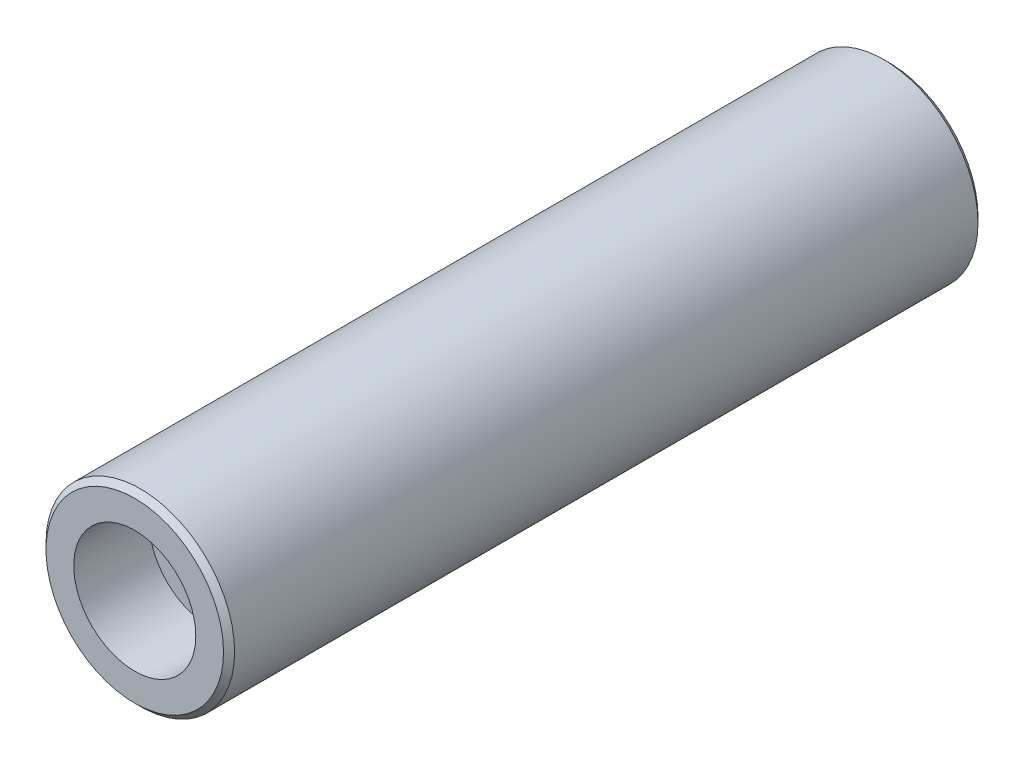
from build123d import *

# Parameters (mm, degrees)
SKETCH_1_R                = 8.5
EXTRUDE_1_DEPTH           = 68
HOLE_WIZARD_1_D           = 7
HOLE_WIZARD_1_CBORE_D     = 11
HOLE_WIZARD_1_CBORE_DEPTH = 6.8
CHAMFER_1_SIZE            = 0.5


with BuildPart() as part:
    # 草图1 → 凸台-拉伸1 (new body)
    with BuildSketch(Plane.XY):
        with Locations((-11.725470696, -50.937423366)):
            Circle(SKETCH_1_R)
    extrude(amount=EXTRUDE_1_DEPTH)

    # 打孔尺寸(%根据)内六角圆柱头螺钉的类型1 (through all)
    with Locations(Plane.XY.offset(68)):
        with Locations((-11.725470696, -50.937423366)):
            CounterBoreHole(HOLE_WIZARD_1_D / 2, HOLE_WIZARD_1_CBORE_D / 2, HOLE_WIZARD_1_CBORE_DEPTH)

    # 倒角1
    chamfer_1_edges = [part.edges().sort_by_distance(p)[0] for p in [
        (-20.225470696, -50.937423366, 0),
        (-20.225470696, -50.937423366, 68),
    ]]
    chamfer(chamfer_1_edges, length=CHAMFER_1_SIZE)


solid = part.part
